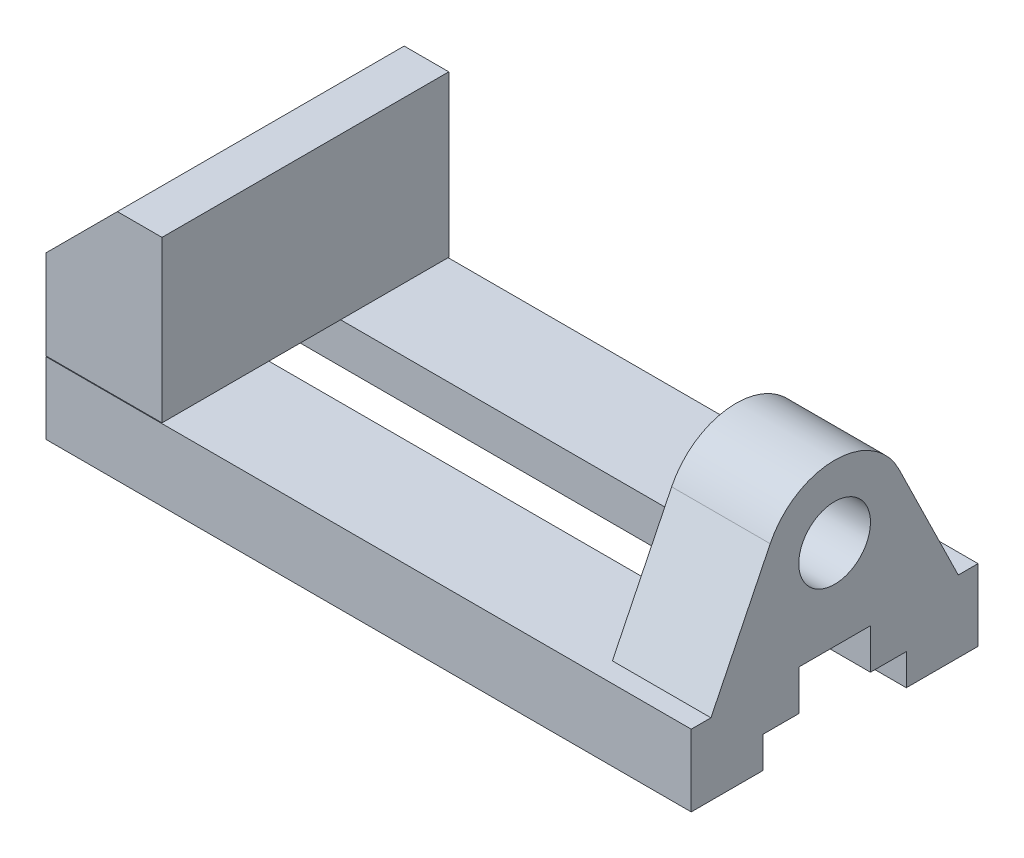
from build123d import *

# Parameters (mm, degrees)
SKETCH1_W           = 144
SKETCH1_H           = 16
BOSS_EXTRUDE1_DEPTH = 32
BOSS_EXTRUDE2_DEPTH = 64
SKETCH3_R           = 8
BOSS_EXTRUDE3_DEPTH = 22
CUT_EXTRUDE1_DEPTH  = 154.935051239


with BuildPart() as part:
    # Sketch1 → Boss-Extrude1 (new, symmetric)
    with BuildSketch(Plane.XY):
        Rectangle(SKETCH1_W, SKETCH1_H)
    extrude(amount=BOSS_EXTRUDE1_DEPTH, both=True)

    # Sketch3 → Boss-Extrude3 (add)
    with BuildSketch(Plane(origin=(72, 0, 0), x_dir=(0, 0, -1), z_dir=(1, 0, 0))):
        with BuildLine():
            Line((-27.596884244, 8), (-32, 8))
            Line((-32, 8), (-32, -8))
            Line((-32, -8), (32, -8))
            Line((32, -8), (32, 8))
            Line((32, 8), (27.596884244, 8))
            Line((27.596884244, 8), (14.372185951, 35.031377602))
            ThreePointArc((14.372185951, 35.031377602), (0, 44), (-14.372185951, 35.031377602))
            Line((-14.372185951, 35.031377602), (-27.596884244, 8))
        make_face()
        with Locations(Location((0, 28, 0), (0, 0, 90))):
            Circle(SKETCH3_R, mode=Mode.SUBTRACT)
    extrude(amount=-BOSS_EXTRUDE3_DEPTH)

    # Sketch4 → Cut-Extrude1 (cut, through all)
    with BuildSketch(Plane(origin=(72, 0, 0), x_dir=(0, 0, -1), z_dir=(1, 0, 0))):
        Polygon((8, 8), (-8, 8), (-8, -1), (-16, -1), (-16, -8), (16, -8), (16, -1), (8, -1), align=None)
    extrude(amount=-CUT_EXTRUDE1_DEPTH, mode=Mode.SUBTRACT)

    # Sketch6 → Cut-Revolve1 (revolve, cut)
    with BuildSketch(Plane.XY.offset(22), mode=Mode.PRIVATE) as cut_revolve1_sk:
        Polygon((34, -2.139952418), (34, -8), (30.65, -8), (30.65, 2), (34, 3.934123402), align=None)
    cut_revolve1 = revolve(cut_revolve1_sk.sketch.rotate(Axis((34, 3.934123402, 22), (0, -1, 0)), 270), axis=Axis((34, 3.934123402, 22), (0, -1, 0)), mode=Mode.SUBTRACT)

    # Sketch7 → Cut-Revolve2 (revolve, cut)
    with BuildSketch(Plane.XY.offset(22), mode=Mode.PRIVATE) as cut_revolve2_sk:
        Polygon((-36, 3.934123402), (-36, -8), (-32.65, -8), (-32.65, 2), align=None)
    cut_revolve2 = revolve(cut_revolve2_sk.sketch.rotate(Axis((-36, 3.934123402, 22), (0, -1, 0)), 180), axis=Axis((-36, 3.934123402, 22), (0, -1, 0)), mode=Mode.SUBTRACT)

    # Mirror2: Cut-Revolve1, Cut-Revolve2 across plane
    add(cut_revolve1.mirror(Plane.XY), mode=Mode.SUBTRACT)
    add(cut_revolve2.mirror(Plane.XY), mode=Mode.SUBTRACT)


with BuildPart() as body_2:
    # Sketch2 → Boss-Extrude2 (new body)
    with BuildSketch(Plane.XY.offset(32)):
        Polygon((-72, 8.15004748), (-46.108367624, 8.15004748), (-46.108367624, 44), (-56.066687769, 44), (-72, 28.066687769), align=None)
    extrude(amount=-BOSS_EXTRUDE2_DEPTH)


solid = Compound([part.part, body_2.part])
